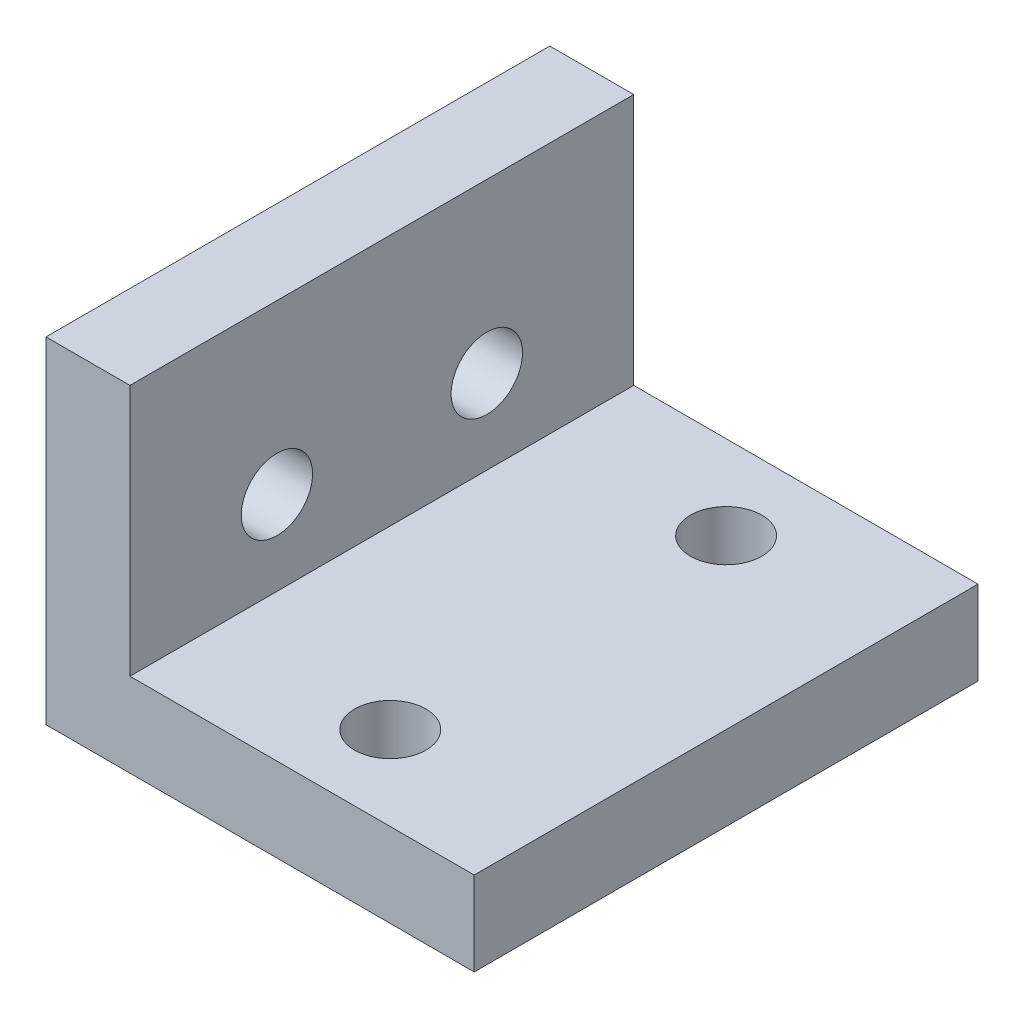
from build123d import *

# Parameters (mm, degrees)
EXTRUDE_1_DEPTH                   = 60
HOLE_WIZARD_8_5_8_5_1_D           = 8.5
HOLE_WIZARD_8_5_8_5_1_ON_FACE_2_D = 8.5


with BuildPart() as part:
    # 草图1 → 凸台-拉伸1 (new body)
    with BuildSketch(Plane.XY):
        Polygon((0, 40), (0, 0), (51, 0), (51, 10), (10, 10), (10, 40), align=None)
    extrude(amount=EXTRUDE_1_DEPTH)

    # Ø8.5 (8.5) 直径孔1 (through all)
    with Locations(Plane(origin=(10, 20, 42.5), x_dir=(0, 0, 1), z_dir=(1, 0, 0))):
        with Locations((0, 0), (-25, 0)):
            Hole(HOLE_WIZARD_8_5_8_5_1_D / 2)

    # Ø8.5 (8.5) 直径孔1 on face 2 (through all)
    with Locations(Plane(origin=(31, 10, 50), x_dir=(0, 0, 1), z_dir=(0, 1, 0))):
        with Locations((0, 0), (-40, 0)):
            Hole(HOLE_WIZARD_8_5_8_5_1_ON_FACE_2_D / 2)


solid = part.part
